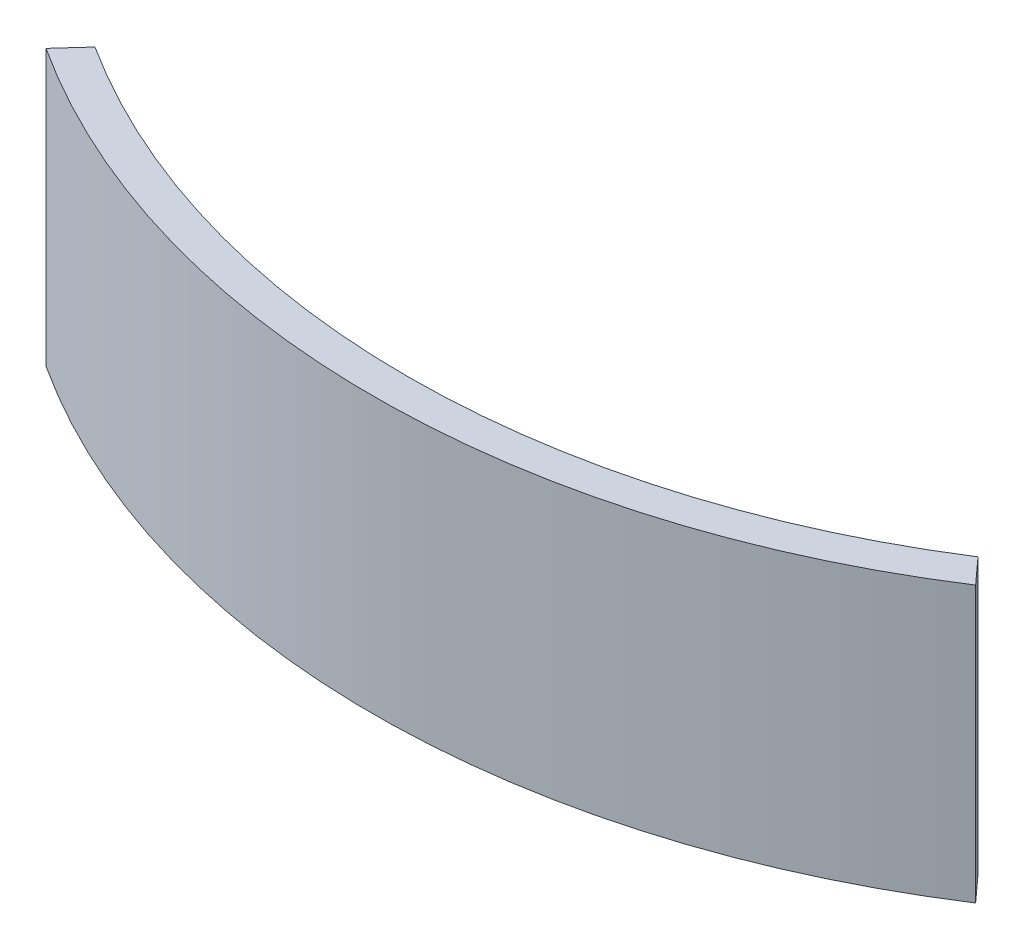
from build123d import *

# Parameters (mm, degrees)
BOSS_EXTRUDE1_DEPTH = 40.3


with BuildPart() as part:
    # Sketch1 → Boss-Extrude1 (new body)
    with BuildSketch(Plane(origin=(0, 0, 0), x_dir=(1, 0, 0), z_dir=(0, 1, 0))):
        with BuildLine():
            Line((-68.034130514, -104.863516464), (-64.630025615, -101.108653383))
            ThreePointArc((-64.630025615, -101.108653383), (0, -120), (64.630025615, -101.108653383))
            Line((64.630025615, -101.108653383), (68.034130514, -104.863516464))
            ThreePointArc((68.034130514, -104.863516464), (0, -125), (-68.034130514, -104.863516464))
        make_face()
    extrude(amount=BOSS_EXTRUDE1_DEPTH)


solid = part.part
